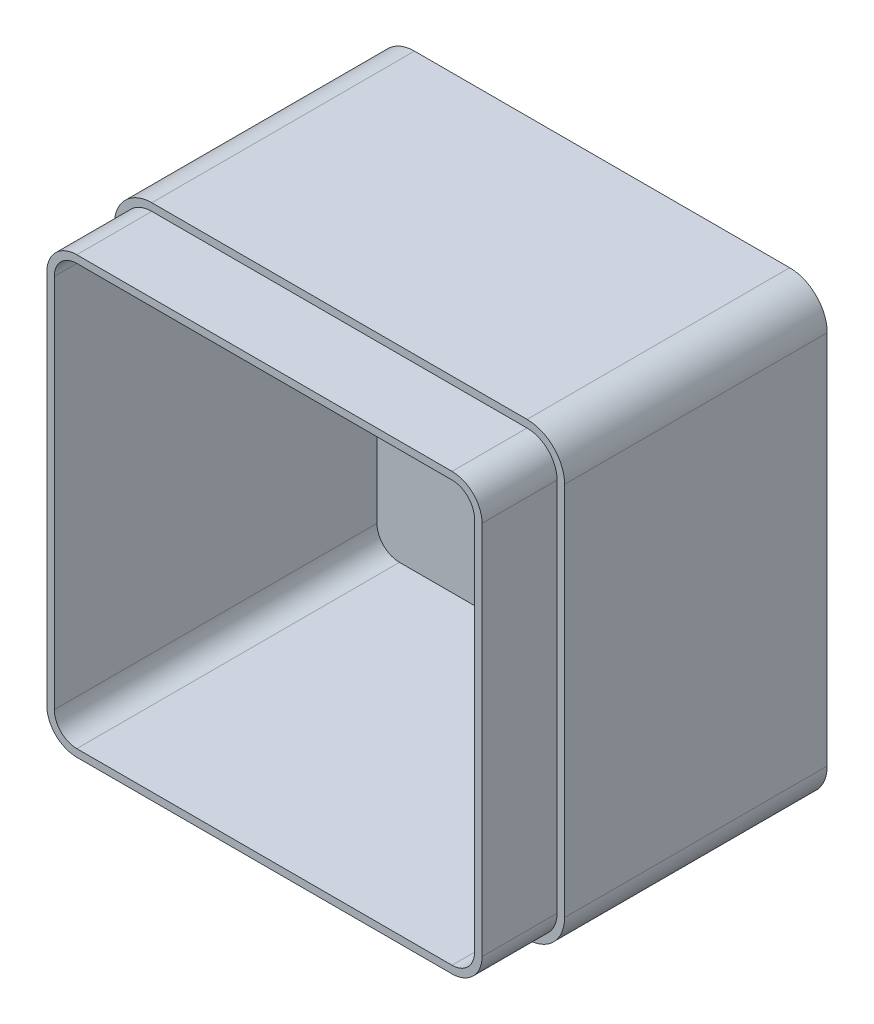
from build123d import *

# Parameters (mm, degrees)
SKETCH_1_W          = 120
SKETCH_1_H          = 120
EXTRUDE_1_DEPTH     = 90
FILLET_1_R          = 10
SHELL_1_T           = -4
CUT_EXTRUDE_3_DEPTH = 20


with BuildPart() as part:
    # Эскиз1 → Бобышка-Вытянуть1 (new body)
    with BuildSketch(Plane.XY):
        with Locations((60, 60)):
            Rectangle(SKETCH_1_W, SKETCH_1_H)
    extrude(amount=EXTRUDE_1_DEPTH)

    # Скругление1
    fillet_1_edges = [part.edges().sort_by_distance(p)[0] for p in [
        (0, 120, 45),
        (120, 120, 45),
        (120, 0, 45),
        (0, 0, 45),
    ]]
    fillet(fillet_1_edges, radius=FILLET_1_R)

    # Оболочка1
    shell_1_openings = [part.faces().sort_by_distance(p)[0] for p in [
        (60, 60, 90),
    ]]
    offset(amount=SHELL_1_T, openings=shell_1_openings, kind=Kind.INTERSECTION)

    # Эскиз5 → Вырез-Вытянуть3 (cut)
    with BuildSketch(Plane.XY.offset(90)):
        with BuildLine():
            Line((0, 110), (0, 10))
            ThreePointArc((0, 10), (2.928932188, 2.928932188), (10, 0))
            Line((10, 0), (110, 0))
            ThreePointArc((110, 0), (117.071067812, 2.928932188), (120, 10))
            Line((120, 10), (120, 110))
            ThreePointArc((120, 110), (117.071067812, 117.071067812), (110, 120))
            Line((110, 120), (10, 120))
            ThreePointArc((10, 120), (2.928932188, 117.071067812), (0, 110))
        make_face()
        with BuildLine():
            Line((2, 110), (2, 10))
            ThreePointArc((2, 10), (4.343145751, 4.343145751), (10, 2))
            Line((10, 2), (110, 2))
            ThreePointArc((110, 2), (115.656854249, 4.343145751), (118, 10))
            Line((118, 10), (118, 110))
            ThreePointArc((118, 110), (115.656854249, 115.656854249), (110, 118))
            Line((110, 118), (10, 118))
            ThreePointArc((10, 118), (4.343145751, 115.656854249), (2, 110))
        make_face(mode=Mode.SUBTRACT)
    extrude(amount=-CUT_EXTRUDE_3_DEPTH, mode=Mode.SUBTRACT)


solid = part.part
